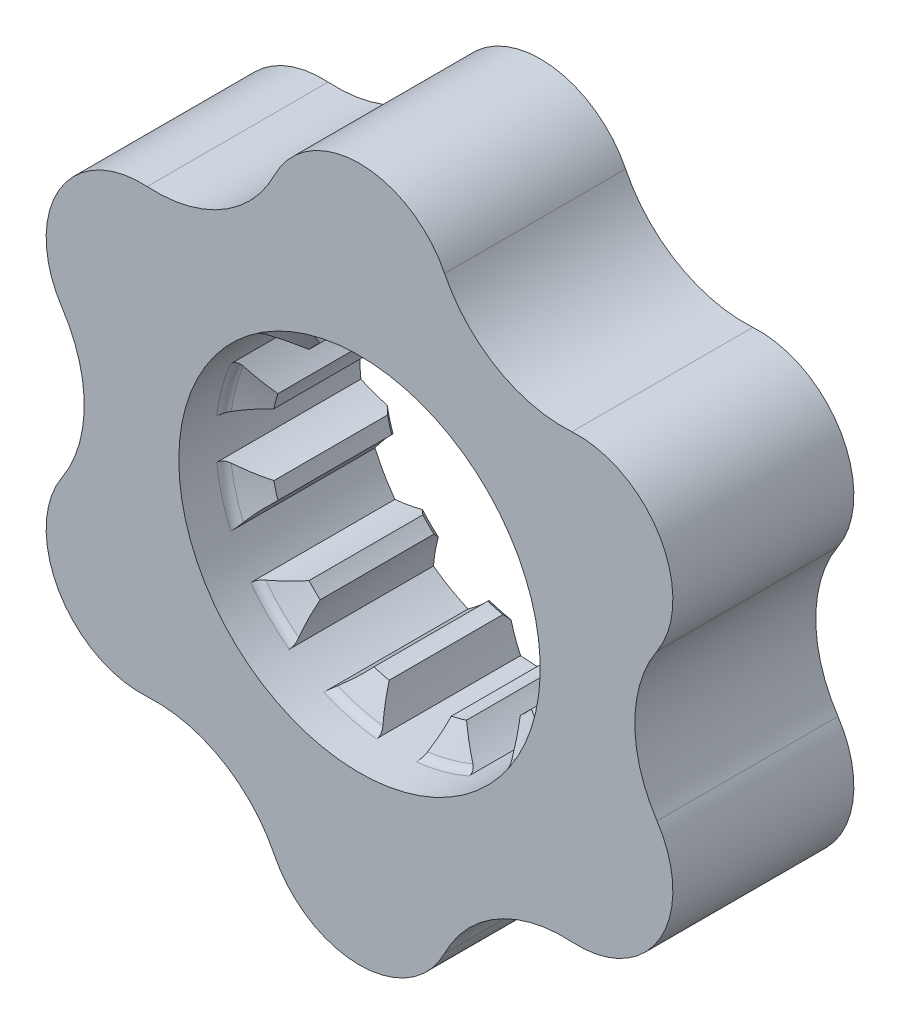
from build123d import *

# Parameters (mm, degrees)
SKETCH1_R         = 11.5
EXTRUDE1_DEPTH    = 13.97
EXTRUDE2_REACH    = 40.712
CIRPATTERN1_COUNT = 12


with BuildPart() as part:
    # Sketch1 → Extrude1 (new body)
    with BuildSketch(Plane.XY):
        with BuildLine():
            ThreePointArc((6.569682114929752, 22.724006281089007), (-2.81e-15, 26.8), (-6.569682114929747, 22.724006281088997))
            ThreePointArc((-6.569682114929747, 22.724006281088997), (-10.62500000000002, 18.403039830419296), (-16.39472565771539, 17.05151474686191))
            ThreePointArc((-16.39472565771539, 17.05151474686191), (-23.209480821423, 13.399999999999931), (-22.964407772645092, 5.672491534226973))
            ThreePointArc((-22.964407772645092, 5.672491534226973), (-21.250000000000004, -1.14e-15), (-22.964407772645092, -5.672491534226974))
            ThreePointArc((-22.964407772645092, -5.672491534226974), (-23.209480821423, -13.399999999999931), (-16.39472565771539, -17.05151474686189))
            ThreePointArc((-16.39472565771539, -17.05151474686189), (-10.625000000000021, -18.403039830419303), (-6.569682114929753, -22.724006281089004))
            ThreePointArc((-6.569682114929753, -22.724006281089004), (-2.81e-15, -26.8), (6.569682114929752, -22.724006281089007))
            ThreePointArc((6.569682114929752, -22.724006281089007), (10.625000000000021, -18.40303983041931), (16.39472565771539, -17.051514746861905))
            ThreePointArc((16.39472565771539, -17.051514746861905), (23.209480821423, -13.399999999999931), (22.964407772645092, -5.672491534226973))
            ThreePointArc((22.964407772645092, -5.672491534226973), (21.25, 1.25e-15), (22.964407772645092, 5.672491534226974))
            ThreePointArc((22.964407772645092, 5.672491534226974), (23.209480821423, 13.399999999999931), (16.39472565771539, 17.051514746861905))
            ThreePointArc((16.39472565771539, 17.051514746861905), (10.625000000000021, 18.40303983041931), (6.569682114929752, 22.724006281089007))
        make_face()
        Circle(SKETCH1_R, mode=Mode.SUBTRACT)
    extrude(amount=EXTRUDE1_DEPTH)

    # Sketch4 → Cut-Revolve1 (revolve, cut)
    with BuildSketch(Plane(origin=(0, 0, 0), x_dir=(0, 0, -1), z_dir=(1, 0, 0)), mode=Mode.PRIVATE) as cut_revolve1_sk:
        with BuildLine():
            Line((0, 0), (-13.969999999999999, -1.73e-15))
            Line((-13.969999999999999, -1.73e-15), (-13.97, 13.949999999999998))
            Line((-13.97, 13.949999999999998), (-11.131880215351696, 13.949999999999998))
            ThreePointArc((-11.131880215351696, 13.949999999999998), (-10.731880215351698, 13.84282032302755), (-10.439059892324149, 13.549999999999999))
            Line((-10.439059892324149, 13.549999999999999), (-9.284359353944883, 11.55))
            Line((-9.284359353944883, 11.55), (-0.49999999999999956, 11.55))
            Line((-0.49999999999999956, 11.55), (3e-17, 12.050000000000004))
            Line((3e-17, 12.050000000000004), (0, 0))
        make_face()
    revolve(cut_revolve1_sk.sketch.rotate(Axis((0, 0, 0), (0, 0, 1)), 90), axis=Axis((0, 0, 0), (0, 0, 1)), mode=Mode.SUBTRACT)

    # Sketch2 → Extrude2 (cut, up to next)
    with BuildSketch(Plane(origin=(0, 0, 0), x_dir=(-1, 0, 0), z_dir=(0, 0, -1)), mode=Mode.PRIVATE) as extrude2_sk1:
        with BuildLine():
            ThreePointArc((1.54, 13.864735843138158), (8.5e-16, 13.95), (-1.54, 13.864735843138158))
            ThreePointArc((-1.54, 13.864735843138158), (-2.0423785970845074, 12.60556685184488), (-2.4, 11.29789803459033))
            ThreePointArc((-2.4, 11.29789803459033), (7.1e-16, 11.550000000000002), (2.4, 11.29789803459033))
            ThreePointArc((2.4, 11.29789803459033), (2.042378597084509, 12.605566851844875), (1.54, 13.864735843138158))
        make_face()
    extrude2_tool1 = extrude(extrude2_sk1.sketch, amount=-EXTRUDE2_REACH, mode=Mode.PRIVATE) & part.part
    extrude2 = extrude2_tool1.solids().sort_by_distance((0, 12.606446, 0))[0]
    add(extrude2, mode=Mode.SUBTRACT)

    # CirPattern1: Extrude2 ×12 about axis
    cirpattern1_axis = Axis((7e-17, -1.9e-16, 0), (0, 0, 1))
    for i in range(1, CIRPATTERN1_COUNT):
        add(extrude2.rotate(cirpattern1_axis, i * 360 / CIRPATTERN1_COUNT), mode=Mode.SUBTRACT)


solid = part.part
